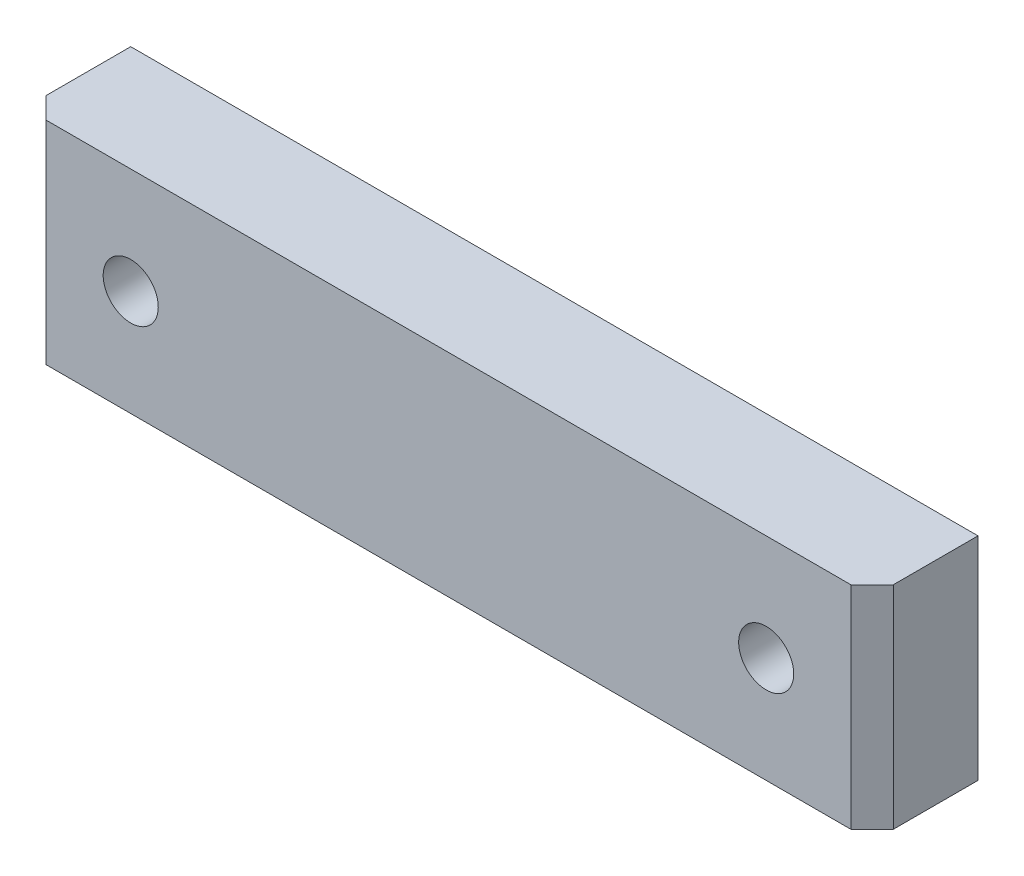
from build123d import *

# Parameters (mm, degrees)
SKETCH_2_W          = 80
SKETCH_2_H          = 20
SKETCH_2_R          = 2.6
EXTRUDE_1_DEPTH     = 10
SKETCH_3_W          = 30
SKETCH_3_H          = 10
CUT_EXTRUDE_1_DEPTH = 5
CHAMFER_1_SIZE      = 2


with BuildPart() as part:
    # Эскиз2 → Бобышка-Вытянуть1 (new body)
    with BuildSketch(Plane.XY):
        Rectangle(SKETCH_2_W, SKETCH_2_H)
        with Locations((-30, 0)):
            Circle(SKETCH_2_R, mode=Mode.SUBTRACT)
        with Locations((30, 0)):
            Circle(SKETCH_2_R, mode=Mode.SUBTRACT)
    extrude(amount=EXTRUDE_1_DEPTH)

    # Эскиз3 → Вырез-Вытянуть1 (cut)
    with BuildSketch(Plane(origin=(0, 0, 0), x_dir=(-1, 0, 0), z_dir=(0, 0, -1))):
        with Locations((0, -5)):
            Rectangle(SKETCH_3_W, SKETCH_3_H)
    extrude(amount=-CUT_EXTRUDE_1_DEPTH, mode=Mode.SUBTRACT)

    # Фаска1
    chamfer_1_edges = [part.edges().sort_by_distance(p)[0] for p in [
        (-40, 0, 10),
        (40, 0, 10),
    ]]
    chamfer(chamfer_1_edges, length=CHAMFER_1_SIZE)


solid = part.part
